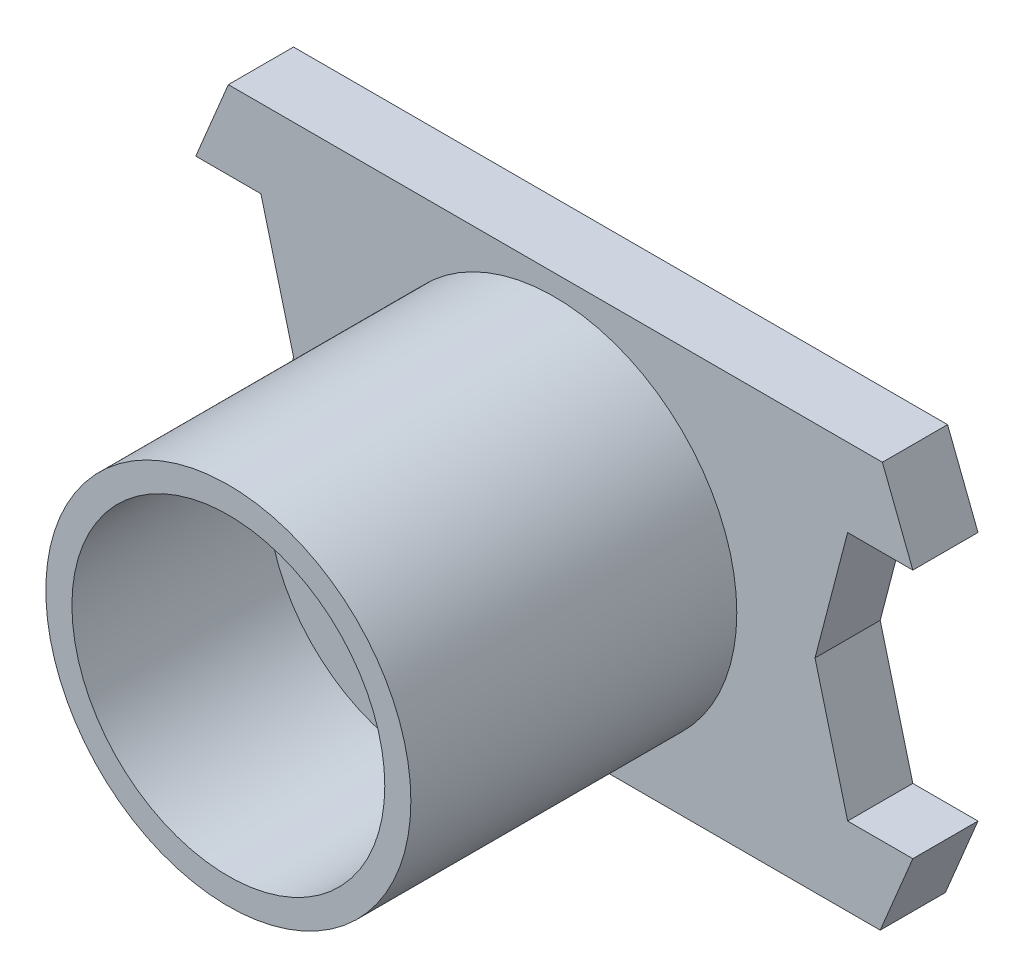
from build123d import *

# Parameters (mm, degrees)
EXTRUDE_1_DEPTH     = 10
SKETCH_2_R          = 28
EXTRUDE_2_DEPTH     = 50
SKETCH_3_R          = 24
CUT_EXTRUDE_1_DEPTH = 30
SKETCH_4_R          = 10
CUT_EXTRUDE_2_DEPTH = 60


with BuildPart() as part:
    # Эскиз1 → Бобышка-Вытянуть1 (new body)
    with BuildSketch(Plane.XY):
        Polygon((45, 19.166666667), (55, 19.166666667), (50.333333333, 31.166666667), (-50, 31.166666667), (-55, 19.166666667), (-45, 19.166666667), (-40, 0), (-45, -19.166666667), (-55, -19.166666667), (-50, -31.166666667), (50, -31.166666667), (55, -19.166666667), (45, -19.166666667), (40, 0), align=None)
    extrude(amount=EXTRUDE_1_DEPTH)

    # Эскиз2 → Бобышка-Вытянуть2 (add)
    with BuildSketch(Plane.XY.offset(10)):
        Circle(SKETCH_2_R)
    extrude(amount=EXTRUDE_2_DEPTH)

    # Эскиз3 → Вырез-Вытянуть1 (cut)
    with BuildSketch(Plane.XY.offset(60)):
        Circle(SKETCH_3_R)
    extrude(amount=-CUT_EXTRUDE_1_DEPTH, mode=Mode.SUBTRACT)

    # Эскиз4 → Вырез-Вытянуть2 (cut)
    with BuildSketch(Plane.XY.offset(30)):
        Circle(SKETCH_4_R)
    extrude(amount=-CUT_EXTRUDE_2_DEPTH, mode=Mode.SUBTRACT)


solid = part.part
